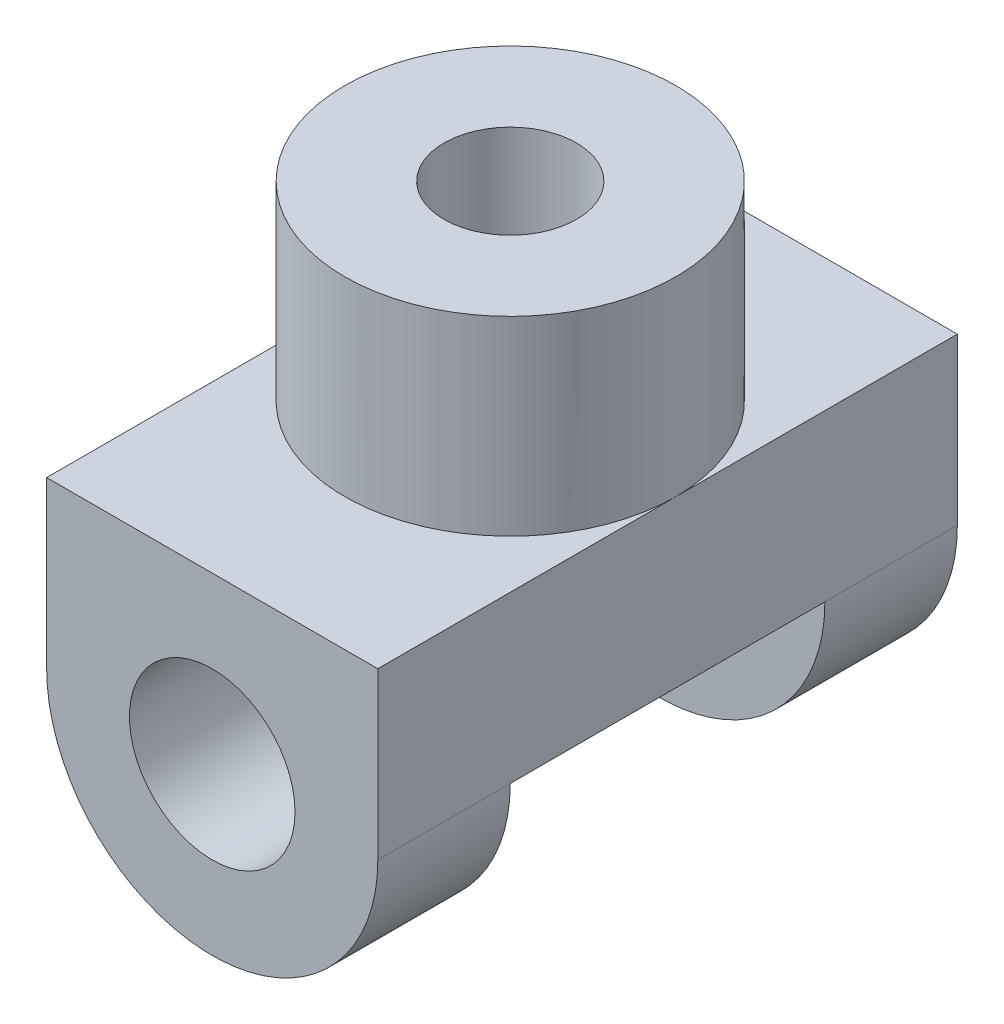
from build123d import *

# Parameters (mm, degrees)
SKETCH1_W           = 1016
SKETCH1_H           = 1778
BOSS_EXTRUDE1_DEPTH = 508
SKETCH2_R           = 508
SKETCH2_R_2         = 203.2
BOSS_EXTRUDE2_DEPTH = 584.2
SKETCH3_R           = 508
BOSS_EXTRUDE3_DEPTH = 406.4
CUT_EXTRUDE1_REACH  = 2149.615
SKETCH5_R           = 254


with BuildPart() as part:
    # Sketch1 → Boss-Extrude1 (new body)
    with BuildSketch(Plane(origin=(0, 0, 0), x_dir=(1, 0, 0), z_dir=(0, 1, 0))):
        Rectangle(SKETCH1_W, SKETCH1_H)
    extrude(amount=BOSS_EXTRUDE1_DEPTH)

    # Sketch2 → Boss-Extrude2 (add)
    with BuildSketch(Plane(origin=(0, 508, 0), x_dir=(1, 0, 0), z_dir=(0, 1, 0))):
        with Locations(Location((0, 25.4, 0), (0, 0, 180))):
            Circle(SKETCH2_R)
        with Locations(Location((0, 25.4, 0), (0, 0, 270))):
            Circle(SKETCH2_R_2, mode=Mode.SUBTRACT)
    extrude(amount=BOSS_EXTRUDE2_DEPTH)

    # Sketch3 → Boss-Extrude3 (add)
    with BuildSketch(Plane.XY.offset(889)):
        Circle(SKETCH3_R)
    boss_extrude3 = extrude(amount=-BOSS_EXTRUDE3_DEPTH)

    # Sketch5 → Cut-Extrude1 (cut, up to next)
    with BuildSketch(Plane.XY.offset(889), mode=Mode.PRIVATE) as cut_extrude1_sk1:
        Circle(SKETCH5_R)
    cut_extrude1_tool1 = extrude(cut_extrude1_sk1.sketch, amount=-CUT_EXTRUDE1_REACH, mode=Mode.PRIVATE) & part.part
    cut_extrude1 = cut_extrude1_tool1.solids().sort_by_distance((0, 0, 889))[0]
    add(cut_extrude1, mode=Mode.SUBTRACT)

    # Mirror1: Boss-Extrude3, Cut-Extrude1 across plane
    add(boss_extrude3.mirror(Plane.XY))
    add(cut_extrude1.mirror(Plane.XY), mode=Mode.SUBTRACT)


solid = part.part
